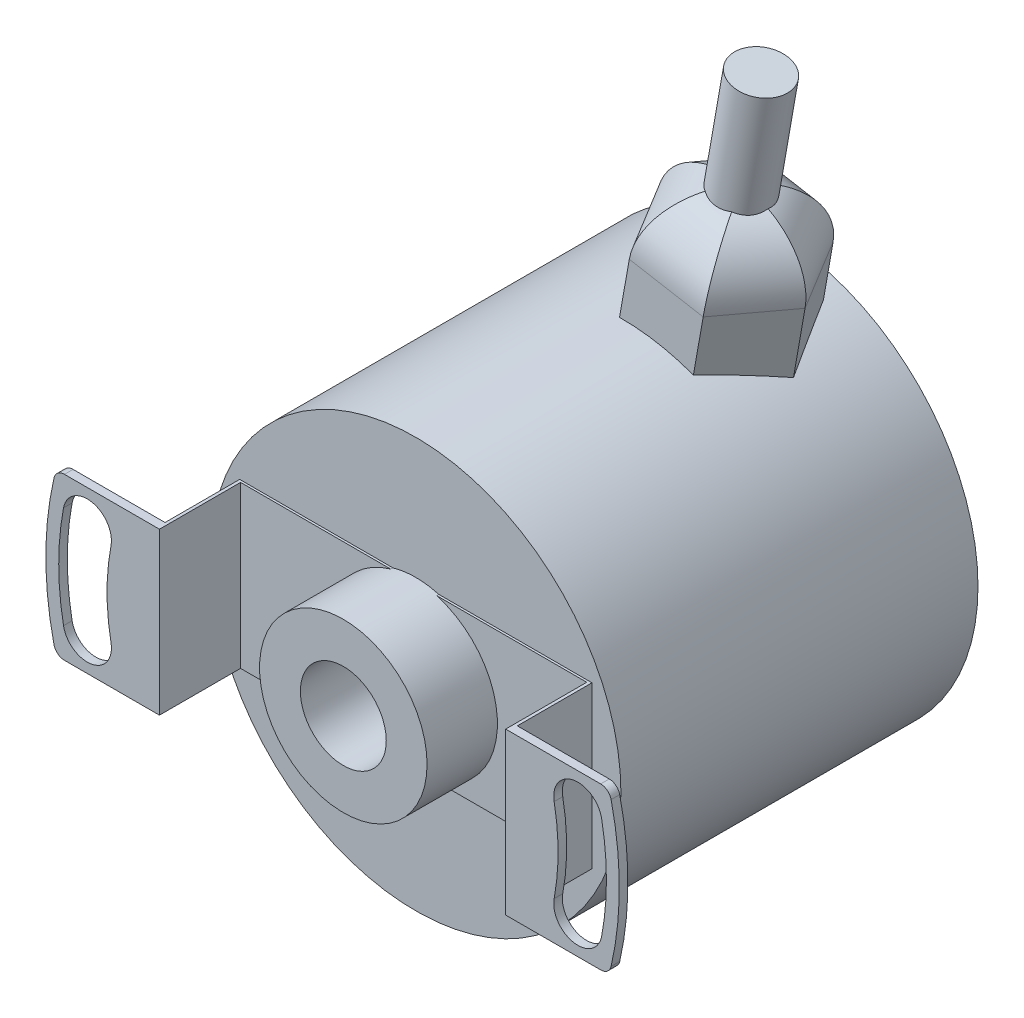
from build123d import *

# Parameters (mm, degrees)
SKETCH1_R            = 19.1
BOSS_EXTRUDE1_DEPTH  = 33.25
SKETCH2_R            = 7.8
SKETCH2_R_2          = 4
BOSS_EXTRUDE2_DEPTH  = 6.75
BOSS_EXTRUDE4_DEPTH  = 7.5
CUT_EXTRUDE1_REACH   = 54.523
FILLET1_R            = 1
FILLET1_OF_MIRROR2_R = 1
CUT_EXTRUDE2_START   = -6.85
SKETCH2_3_R          = 4
CUT_EXTRUDE2_DEPTH   = 13.6
BOSS_EXTRUDE5_DEPTH  = 30
FILLET2_R            = 6
SKETCH6_R            = 2.5
BOSS_EXTRUDE6_DEPTH  = 40


with BuildPart() as part:
    # Sketch1 → Boss-Extrude1 (new body)
    with BuildSketch(Plane.XY):
        Circle(SKETCH1_R)
    extrude(amount=-BOSS_EXTRUDE1_DEPTH)

    # Sketch2 → Boss-Extrude2 (add)
    with BuildSketch(Plane.XY):
        Circle(SKETCH2_R)
        Circle(SKETCH2_R_2, mode=Mode.SUBTRACT)
    extrude(amount=BOSS_EXTRUDE2_DEPTH)

    # Sketch3 → Boss-Extrude4 (add, symmetric)
    with BuildSketch(Plane(origin=(0, 0, 0), x_dir=(1, 0, 0), z_dir=(0, 1, 0))):
        Polygon((26.7, -6.95), (26.7, -7.75), (16.12, -7.75), (16.12, -0.2), (0, -0.2), (0, 0), (16.4, 0), (16.4, -6.95), align=None)
    boss_extrude4 = extrude(amount=BOSS_EXTRUDE4_DEPTH, both=True)

    # Sketch4 → Cut-Extrude1 (cut, up to next)
    with BuildSketch(Plane.XY.offset(7.75), mode=Mode.PRIVATE) as cut_extrude1_sk1:
        with BuildLine():
            ThreePointArc((25.0538758, -4.749032258), (25.5, 0), (25.0538758, 4.749032258))
            ThreePointArc((25.0538758, 4.749032258), (22.424207442, 6.5406361), (20.6326036, 3.910967742))
            ThreePointArc((20.6326036, 3.910967742), (21, 0), (20.6326036, -3.910967742))
            ThreePointArc((20.6326036, -3.910967742), (22.424207442, -6.5406361), (25.0538758, -4.749032258))
        make_face()
    cut_extrude1_tool1 = extrude(cut_extrude1_sk1.sketch, amount=-CUT_EXTRUDE1_REACH, mode=Mode.PRIVATE) & part.part
    # Sketch4 → Cut-Extrude1 (cut, up to next)
    with BuildSketch(Plane.XY.offset(7.75), mode=Mode.PRIVATE) as cut_extrude1_sk2:
        with BuildLine():
            ThreePointArc((26.7, -1.8e-08), (26.461554926, -3.779963633), (25.75, -7.5))
            Line((25.75, -7.5), (26.7, -7.5))
            Line((26.7, -7.5), (26.7, -1.8e-08))
        make_face()
    cut_extrude1_tool2 = extrude(cut_extrude1_sk2.sketch, amount=-CUT_EXTRUDE1_REACH, mode=Mode.PRIVATE) & part.part
    # Sketch4 → Cut-Extrude1 (cut, up to next)
    with BuildSketch(Plane.XY.offset(7.75), mode=Mode.PRIVATE) as cut_extrude1_sk3:
        with BuildLine():
            ThreePointArc((25.75, 7.5), (26.461554929, 3.779963615), (26.7, -1.8e-08))
            Line((26.7, -1.8e-08), (26.7, 7.5))
            Line((26.7, 7.5), (25.75, 7.5))
        make_face()
    cut_extrude1_tool3 = extrude(cut_extrude1_sk3.sketch, amount=-CUT_EXTRUDE1_REACH, mode=Mode.PRIVATE) & part.part
    cut_extrude1_1 = cut_extrude1_tool1.solids().sort_by_distance((23.036032, 0, 7.75))[0]
    add(cut_extrude1_1, mode=Mode.SUBTRACT)
    cut_extrude1_2 = cut_extrude1_tool2.solids().sort_by_distance((26.415788, -5.630973, 7.75))[0]
    add(cut_extrude1_2, mode=Mode.SUBTRACT)
    cut_extrude1_3 = cut_extrude1_tool3.solids().sort_by_distance((26.415788, 5.630973, 7.75))[0]
    add(cut_extrude1_3, mode=Mode.SUBTRACT)
    cut_extrude1 = cut_extrude1_1 + cut_extrude1_2 + cut_extrude1_3  # Cut-Extrude1 as one shape, for the pattern or mirror that repeats it

    # Fillet1
    fillet1_edges = [part.edges().sort_by_distance(p)[0] for p in [
        (25.75, -7.5, 7.35),
        (25.75, 7.5, 7.35),
    ]]
    fillet(fillet1_edges, radius=FILLET1_R)

    # Mirror2: Boss-Extrude4, Cut-Extrude1 across plane
    add(boss_extrude4.mirror(Plane(origin=(0, 0, 0), x_dir=(0, 0, 1), z_dir=(1, 0, 0))))
    add(cut_extrude1.mirror(Plane(origin=(0, 0, 0), x_dir=(0, 0, 1), z_dir=(1, 0, 0))), mode=Mode.SUBTRACT)

    # Fillet1 of Mirror2
    fillet1_of_mirror2_edges = [part.edges().sort_by_distance(p)[0] for p in [
        (-25.75, -7.5, 7.35),
        (-25.75, 7.5, 7.35),
    ]]
    fillet(fillet1_of_mirror2_edges, radius=FILLET1_OF_MIRROR2_R)

    # Sketch2<3> → Cut-Extrude2 (cut)
    with BuildSketch(Plane.XY.offset(CUT_EXTRUDE2_START)):
        Circle(SKETCH2_3_R)
    extrude(amount=CUT_EXTRUDE2_DEPTH, mode=Mode.SUBTRACT)

    # Sketch5 → Boss-Extrude5 (add)
    with BuildSketch(Plane(origin=(0, 0, 0), x_dir=(0, 0, 1), z_dir=(0.17364817766693072, 0.984807753012208, 0))):
        Polygon((-31.25, -3.492969129), (-25.2, -6.985938257), (-19.15, -3.492969129), (-19.15, 3.492969129), (-25.2, 6.985938257), (-31.25, 3.492969129), align=None)
    extrude(amount=BOSS_EXTRUDE5_DEPTH)

    # Fillet2
    fillet2_edges = [part.edges().sort_by_distance(p)[0] for p in [
        (5.20944533, 29.54423259, -31.25),
        (0.049590712, 30.454054176, -28.225),
        (0.049590712, 30.454054176, -22.175),
        (5.20944533, 29.54423259, -19.15),
        (10.369299948, 28.634411005, -22.175),
        (10.369299948, 28.634411005, -28.225),
    ]]
    fillet(fillet2_edges, radius=FILLET2_R)

    # Sketch6 → Boss-Extrude6 (add)
    with BuildSketch(Plane(origin=(0, 0, 0), x_dir=(0, 0, 1), z_dir=(0.17364817766693072, 0.984807753012208, 0))):
        with Locations(Location((-25.2, 0, 0), (0, 0, 90))):
            Circle(SKETCH6_R)
    extrude(amount=BOSS_EXTRUDE6_DEPTH)


solid = part.part
